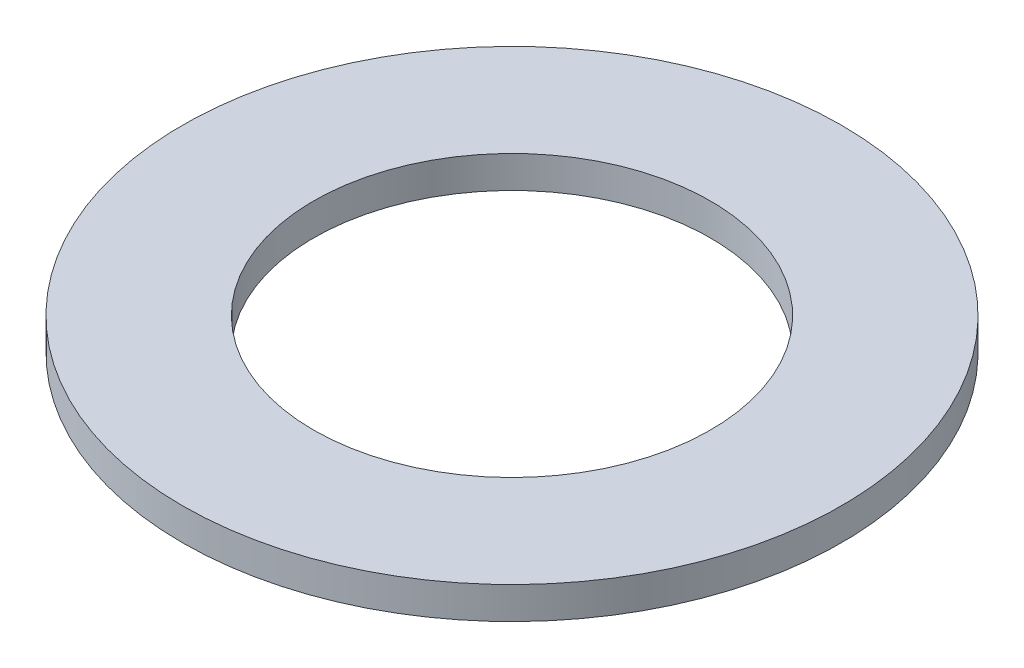
from build123d import *

# Parameters (mm, degrees)
SKETCH1_R           = 82.2
SKETCH1_R_2         = 49.5
BOSS_EXTRUDE1_DEPTH = 8


with BuildPart() as part:
    # Sketch1 → Boss-Extrude1 (new body)
    with BuildSketch(Plane(origin=(0, 0, 0), x_dir=(1, 0, 0), z_dir=(0, 1, 0))):
        with Locations(Location((0, 0, 0), (0, 0, 270))):
            Circle(SKETCH1_R)
        with Locations(Location((0, 0, 0), (0, 0, 270))):
            Circle(SKETCH1_R_2, mode=Mode.SUBTRACT)
    extrude(amount=BOSS_EXTRUDE1_DEPTH)


solid = part.part
